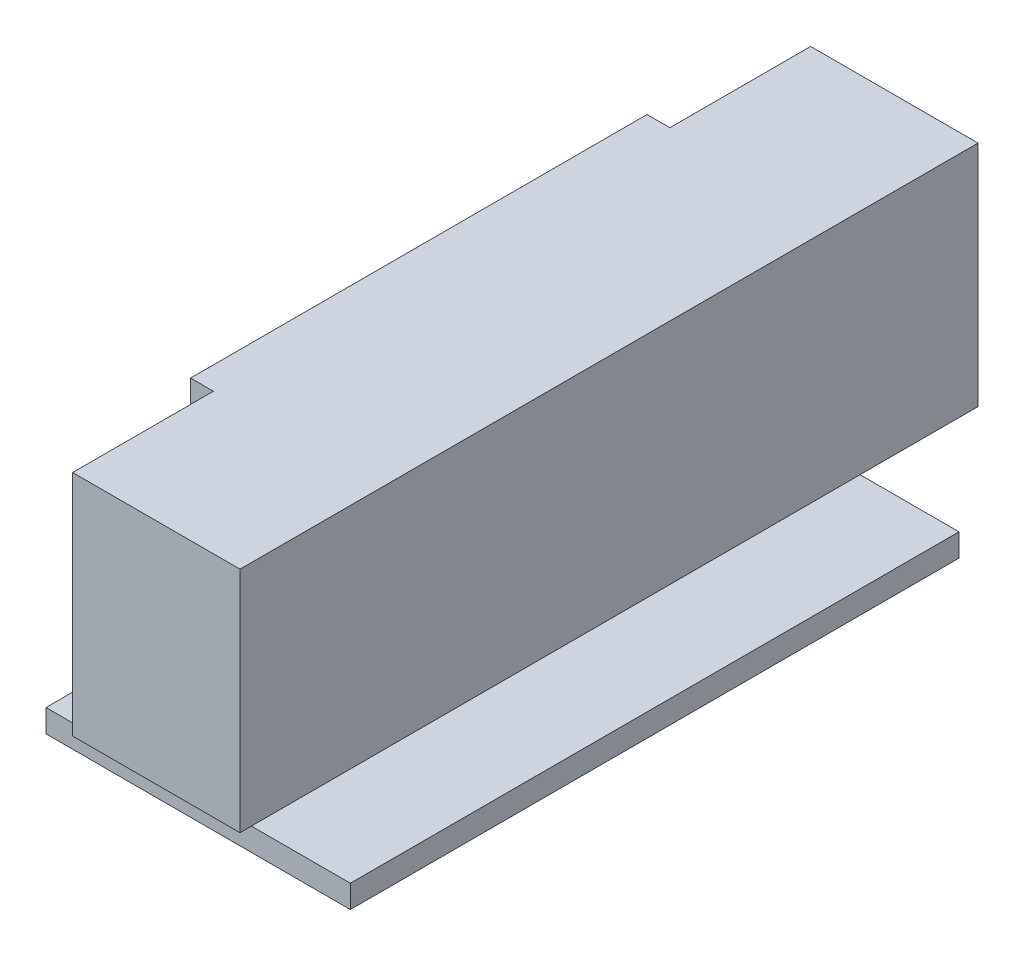
from build123d import *

# Parameters (mm, degrees)
SK_P01_BRACKETBASE_W     = 40
SK_P01_BRACKETBASE_H     = 80
P01_BRACKETBASE_DEPTH    = 3
SK_P02_BRACKETUPRIGHT_W  = 3
SK_P02_BRACKETUPRIGHT_H  = 60
P02_BRACKETUPRIGHT_DEPTH = 40
P03_CAMERA_START         = 10
SK_P03_CAMERA_W          = 22
SK_P03_CAMERA_H          = 97
P03_CAMERA_DEPTH         = 30


with BuildPart() as part:
    # SK_P01_Bracketbase → P01_Bracketbase (new body)
    with BuildSketch(Plane(origin=(0, 0, 0), x_dir=(1, 0, 0), z_dir=(0, 1, 0))):
        Rectangle(SK_P01_BRACKETBASE_W, SK_P01_BRACKETBASE_H)
    extrude(amount=P01_BRACKETBASE_DEPTH)

    # SK_P02_Bracketupright → P02_Bracketupright (add)
    with BuildSketch(Plane(origin=(0, 0, 0), x_dir=(1, 0, 0), z_dir=(0, 1, 0))):
        with Locations((-9.5, 0)):
            Rectangle(SK_P02_BRACKETUPRIGHT_W, SK_P02_BRACKETUPRIGHT_H)
    extrude(amount=P02_BRACKETUPRIGHT_DEPTH)

    # SK_P03_Camera → P03_Camera (add)
    with BuildSketch(Plane(origin=(0, 0, 0), x_dir=(1, 0, 0), z_dir=(0, 1, 0)).offset(P03_CAMERA_START)):
        with Locations((3, 0)):
            Rectangle(SK_P03_CAMERA_W, SK_P03_CAMERA_H)
    extrude(amount=P03_CAMERA_DEPTH)


solid = part.part
